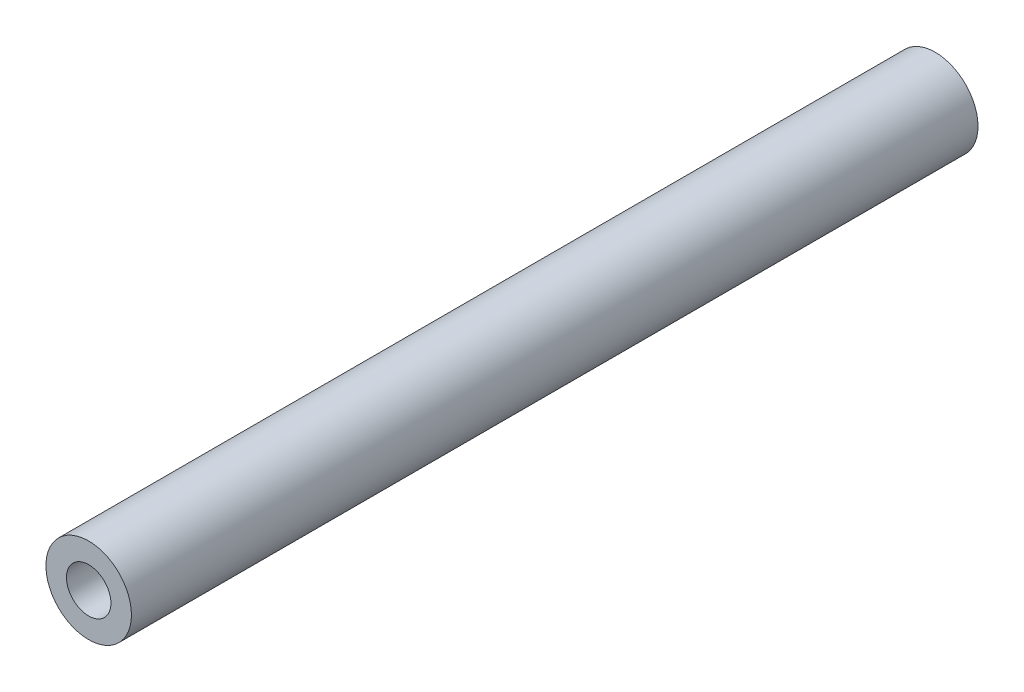
from build123d import *

# Parameters (mm, degrees)
SKETCH1_R                 = 2.5
BOSS_EXTRUDE1_DEPTH       = 49.5
M3X0_5_TAPPED_HOLE1_D     = 2.6
M3X0_5_TAPPED_HOLE1_DEPTH = 8
M3X0_5_TAPPED_HOLE1_TIP   = 0.781118805
M3X0_5_TAPPED_HOLE2_D     = 2.6
M3X0_5_TAPPED_HOLE2_DEPTH = 8
M3X0_5_TAPPED_HOLE2_TIP   = 0.781118805


with BuildPart() as part:
    # Sketch1 → Boss-Extrude1 (new body)
    with BuildSketch(Plane.XY):
        Circle(SKETCH1_R)
    extrude(amount=BOSS_EXTRUDE1_DEPTH)

    # M3x0.5 Tapped Hole1
    with Locations(Plane.XY.offset(49.5)):
        with Locations((0, 0)):
            Hole(M3X0_5_TAPPED_HOLE1_D / 2, depth=M3X0_5_TAPPED_HOLE1_DEPTH)
            with Locations((0, 0, -(M3X0_5_TAPPED_HOLE1_DEPTH + M3X0_5_TAPPED_HOLE1_TIP / 2))):  # 118° drill point
                Cone(0, M3X0_5_TAPPED_HOLE1_D / 2, M3X0_5_TAPPED_HOLE1_TIP, mode=Mode.SUBTRACT)

    # M3x0.5 Tapped Hole2
    with Locations(Plane(origin=(0, 0, 0), x_dir=(-1, 0, 0), z_dir=(0, 0, -1))):
        with Locations((0, 0)):
            Hole(M3X0_5_TAPPED_HOLE2_D / 2, depth=M3X0_5_TAPPED_HOLE2_DEPTH)
            with Locations((0, 0, -(M3X0_5_TAPPED_HOLE2_DEPTH + M3X0_5_TAPPED_HOLE2_TIP / 2))):  # 118° drill point
                Cone(0, M3X0_5_TAPPED_HOLE2_D / 2, M3X0_5_TAPPED_HOLE2_TIP, mode=Mode.SUBTRACT)


solid = part.part
